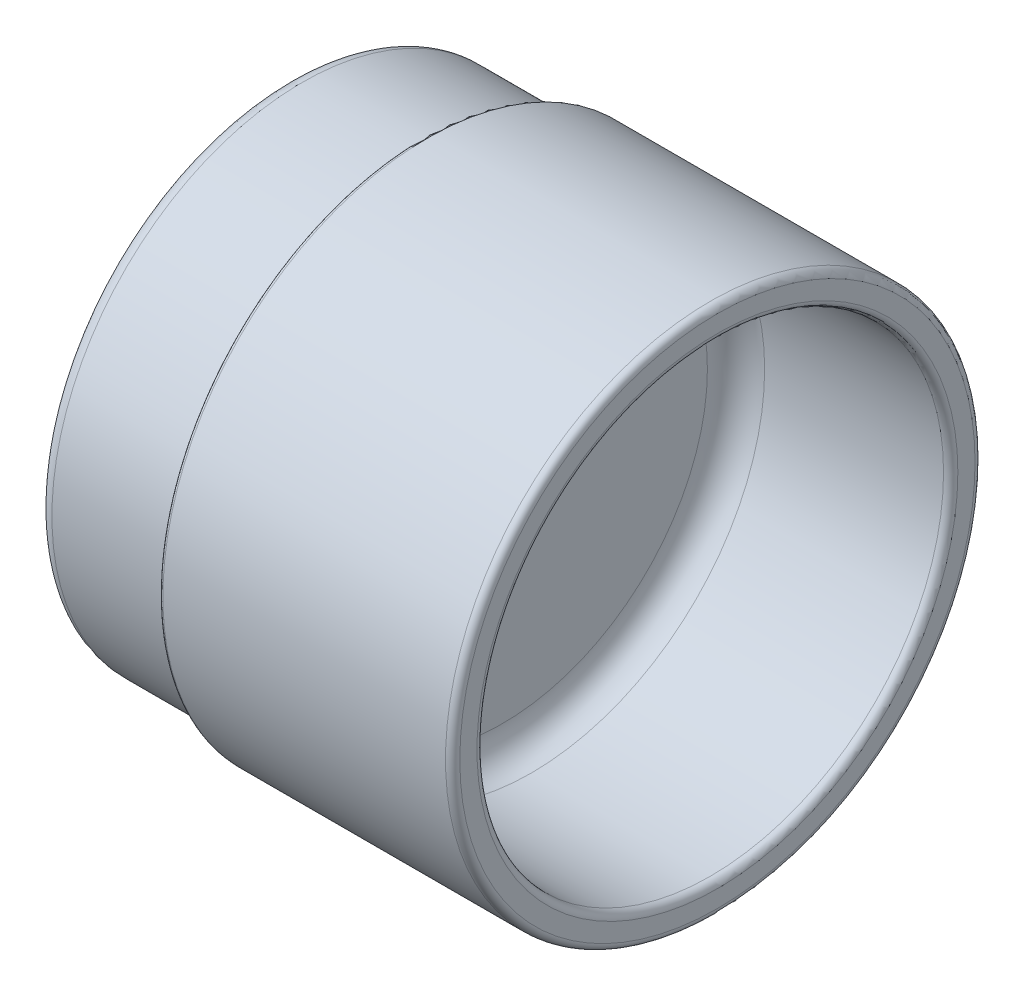
from build123d import *


with BuildPart() as part:
    # Sketch1 → Revolve1 (revolve)
    with BuildSketch(Plane(origin=(0, 0, 0), x_dir=(1, 0, 0), z_dir=(0, 1, 0))):
        with BuildLine():
            Line((0, 0), (0, 33))
            ThreePointArc((0, 33), (0.585786438, 34.414213562), (2, 35))
            Line((2, 35), (19, 35))
            Line((19, 35), (19, 36.5))
            ThreePointArc((19, 36.5), (19.146446609, 36.853553391), (19.5, 37))
            Line((19.5, 37), (59, 37))
            ThreePointArc((59, 37), (59.707106781, 36.707106781), (60, 36))
            Line((60, 36), (60, 33.6))
            ThreePointArc((60, 33.6), (59.707106781, 32.892893219), (59, 32.6))
            Line((59, 32.6), (34, 32.6))
            ThreePointArc((34, 32.6), (31.171572875, 31.428427125), (30, 28.6))
            Line((30, 28.6), (30, 0))
            Line((30, 0), (0, 0))
        make_face()
    revolve(axis=Axis((30, 0, 0), (-1, 0, 0)))


solid = part.part
